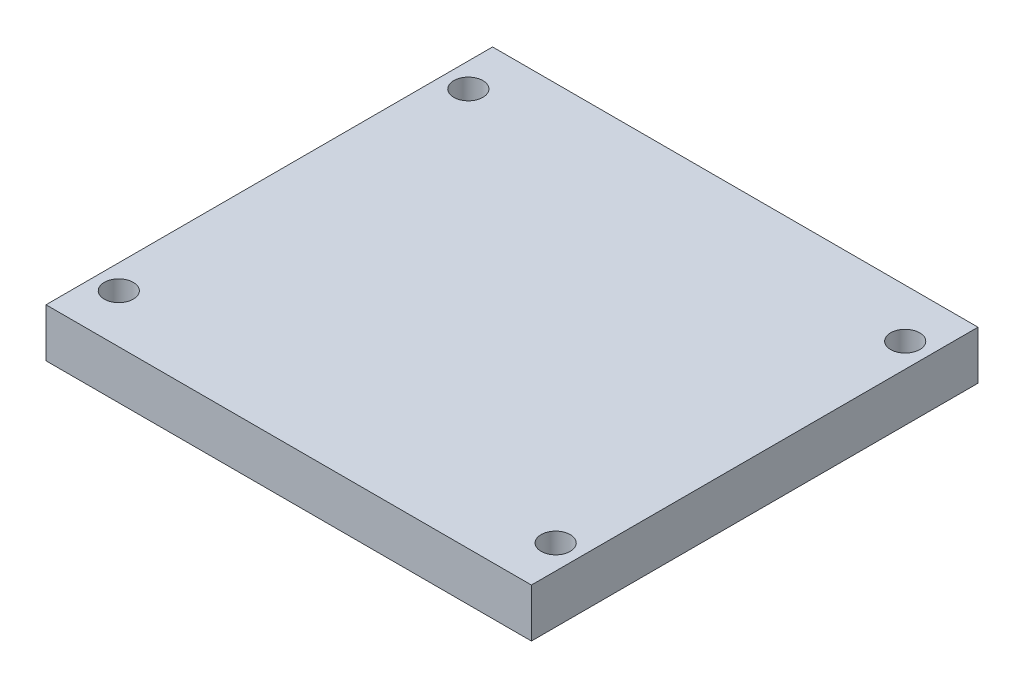
from build123d import *

# Parameters (mm, degrees)
SKETCH1_W           = 25
SKETCH1_H           = 46
SKETCH1_R           = 1.5
BOSS_EXTRUDE1_DEPTH = 5


with BuildPart() as part:
    # Sketch1 → Boss-Extrude1 (new body)
    with BuildSketch(Plane(origin=(0, 0, 0), x_dir=(1, 0, 0), z_dir=(0, 1, 0))):
        with Locations((12.5, 23)):
            Rectangle(SKETCH1_W, SKETCH1_H)
        with Locations(Location((22.5, 5, 0), (0, 0, 270))):
            Circle(SKETCH1_R, mode=Mode.SUBTRACT)
        with Locations(Location((22.5, 41, 0), (0, 0, 270))):
            Circle(SKETCH1_R, mode=Mode.SUBTRACT)
    boss_extrude1 = extrude(amount=BOSS_EXTRUDE1_DEPTH)

    # Mirror1: Boss-Extrude1 across plane
    add(boss_extrude1.mirror(Plane(origin=(0, 5, 0), x_dir=(0, 0, 1), z_dir=(1, 0, 0))))


solid = part.part
